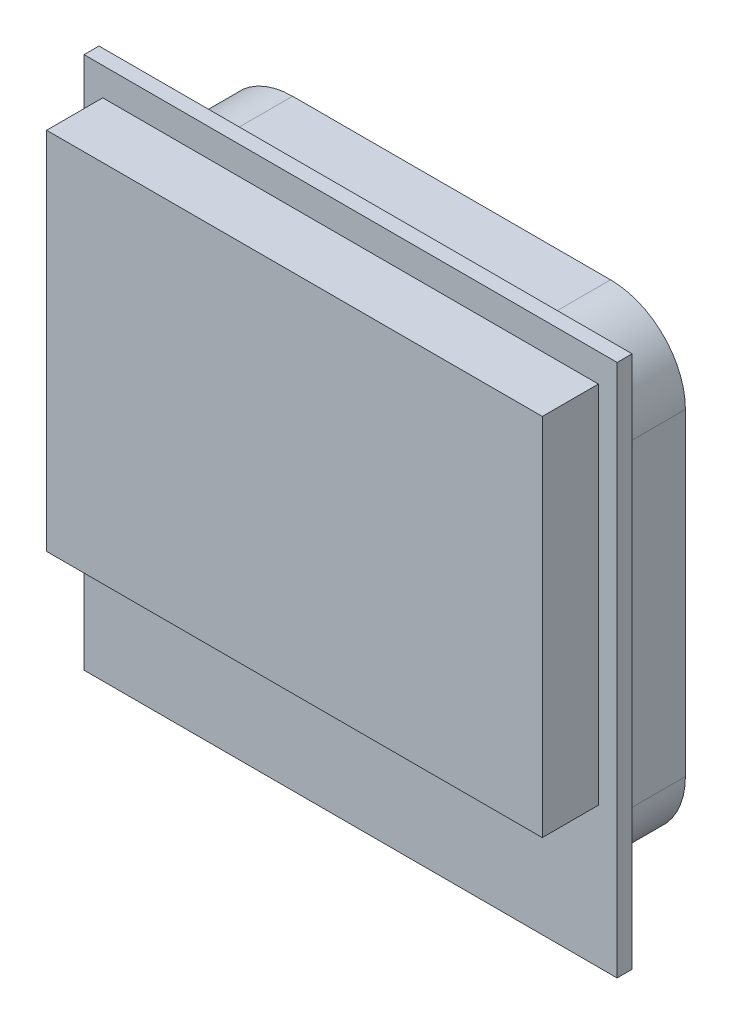
from build123d import *

# Parameters (mm, degrees)
SKETCH_1_W      = 28.5
SKETCH_1_H      = 28.5
EXTRUDE_1_DEPTH = 0.8
SKETCH_2_W      = 26.5
SKETCH_2_H      = 19.5
EXTRUDE_2_DEPTH = 3
EXTRUDE_START   = -3.8
EXTRUDE_3_DEPTH = 4.6


with BuildPart() as part:
    # Эскиз1 → Бобышка-Вытянуть1 (new body)
    with BuildSketch(Plane.XY):
        Rectangle(SKETCH_1_W, SKETCH_1_H)
    extrude(amount=EXTRUDE_1_DEPTH)

    # Эскиз2 → Бобышка-Вытянуть2 (add)
    with BuildSketch(Plane.XY.offset(0.8)):
        with Locations((0, 3)):
            Rectangle(SKETCH_2_W, SKETCH_2_H)
    extrude(amount=EXTRUDE_2_DEPTH)

    # Эскиз5 → Бобышка-Вытянуть3 (add)
    with BuildSketch(Plane.XY.offset(3.8).offset(EXTRUDE_START)):
        with BuildLine():
            Line((-8.5, -12.5), (8.5, -12.5))
            ThreePointArc((8.5, -12.5), (11.328427125, -11.328427125), (12.5, -8.5))
            Line((12.5, -8.5), (12.5, 8.5))
            ThreePointArc((12.5, 8.5), (11.328427125, 11.328427125), (8.5, 12.5))
            Line((8.5, 12.5), (-8.5, 12.5))
            ThreePointArc((-8.5, 12.5), (-11.328427125, 11.328427125), (-12.5, 8.5))
            Line((-12.5, 8.5), (-12.5, -8.5))
            ThreePointArc((-12.5, -8.5), (-11.328427125, -11.328427125), (-8.5, -12.5))
        make_face()
    extrude(amount=-EXTRUDE_3_DEPTH)


solid = part.part
